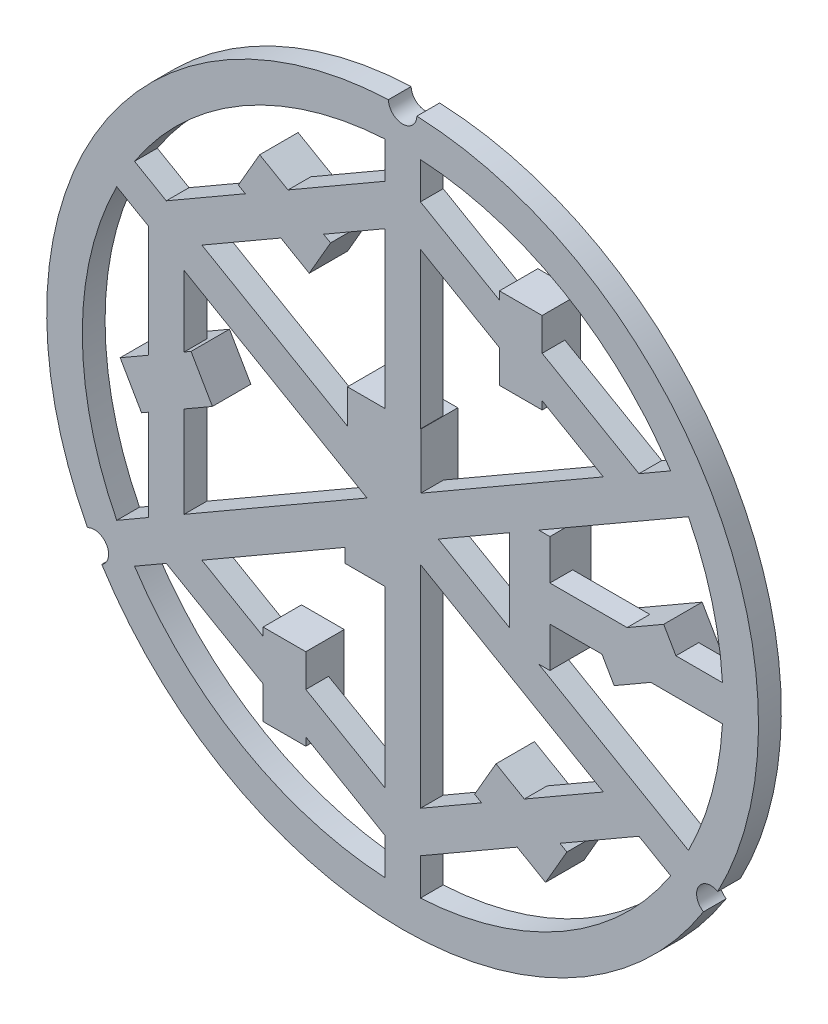
from build123d import *

# Parameters (mm, degrees)
BASE_SKETCH_R        = 25
BOARD_DEPTH          = 1.6
ALIGNMENT_SLOTS_D    = 2
EXTRUSION_BASE_W     = 3
EXTRUSION_BASE_H     = 5.75
LEDS_DEPTH           = 1.1
EXTRUSION_BASE_3_W   = 5.15
EXTRUSION_BASE_3_H   = 5.15
EXTRUSION_BASE_3_W_2 = 3.1
EXTRUSION_BASE_3_H_2 = 3.1
ICS_DEPTH            = 1
EXTRUSION_BASE_4_W   = 2.85
EXTRUSION_BASE_4_H   = 8.15
CONNECTOR_DEPTH      = 1.3
EXTRA_MASS_CUT_DEPTH = 36.391524409


with BuildPart() as part:
    # Base sketch → Board (new body)
    with BuildSketch(Plane.XY):
        Circle(BASE_SKETCH_R)
    extrude(amount=BOARD_DEPTH)

    # Alignment slots (through all)
    with Locations(Plane.XY.offset(1.6)):
        with Locations((0, 25), (21.650635095, -12.5), (-21.650635095, -12.5)):
            Hole(ALIGNMENT_SLOTS_D / 2)

    # Extrusion base → LEDs (add)
    with BuildSketch(Plane(origin=(0, 0, 0), x_dir=(-1, 0, 0), z_dir=(0, 0, -1))):
        Polygon((11.539823036, 14.514483597), (10.039823036, 17.112559808), (5.060176964, 14.237559808), (6.560176964, 11.639483597), align=None)
        with Locations((-8.3, 14.376021703)):
            Rectangle(EXTRUSION_BASE_W, EXTRUSION_BASE_H)
        Polygon((18.339823036, -2.736538106), (19.839823036, -0.138461894), (14.860176964, 2.736538106), (13.360176964, 0.138461894), align=None)
        with Locations((8.3, -14.376021703)):
            Rectangle(EXTRUSION_BASE_W, EXTRUSION_BASE_H)
        Polygon((-11.539823036, -14.514483597), (-10.039823036, -17.112559808), (-5.060176964, -14.237559808), (-6.560176964, -11.639483597), align=None)
        Polygon((-18.339823036, 2.736538106), (-19.839823036, 0.138461894), (-14.860176964, -2.736538106), (-13.360176964, -0.138461894), align=None)
    extrude(amount=LEDS_DEPTH)

    # Extrusion base<3> → ICs (add)
    with BuildSketch(Plane(origin=(0, 0, 0), x_dir=(-1, 0, 0), z_dir=(0, 0, -1))):
        with Locations((1.3, 3.5)):
            Rectangle(EXTRUSION_BASE_3_W, EXTRUSION_BASE_3_H)
        with Locations((2.5, -3.2)):
            Rectangle(EXTRUSION_BASE_3_W_2, EXTRUSION_BASE_3_H_2)
    extrude(amount=ICS_DEPTH)

    # Extrusion base<4> → Connector (add)
    with BuildSketch(Plane(origin=(0, 0, 0), x_dir=(-1, 0, 0), z_dir=(0, 0, -1))):
        with Locations((-8.92, 0)):
            Rectangle(EXTRUSION_BASE_4_W, EXTRUSION_BASE_4_H)
    extrude(amount=CONNECTOR_DEPTH)

    # Negative base → Extra mass cut (cut, through all)
    with BuildSketch(Plane(origin=(0, 0, 0), x_dir=(-1, 0, 0), z_dir=(0, 0, -1))):
        Polygon((3.875, 3.680607966), (14.1, 9.584014469), (8.55, 12.788308463), (6.560176964, 11.639483597), (5.060176964, 14.237559808), (5.55, 14.52035927), (1.25, 17.002965428), (1.25, 6.075), (3.875, 6.075), align=None)
        with BuildLine():
            Line((11.05, 14.231684136), (16.6, 11.027390142))
            Line((16.6, 11.027390142), (18.83047802, 12.315157227))
            ThreePointArc((18.83047802, 12.315157227), (11.25, 19.485571585), (1.25, 22.465250945))
            Line((1.25, 22.465250945), (1.25, 19.889716774))
            Line((1.25, 19.889716774), (8.05, 15.963734943))
            Line((8.05, 15.963734943), (10.039823036, 17.112559808))
            Line((10.039823036, 17.112559808), (11.539823036, 14.514483597))
            Line((11.539823036, 14.514483597), (11.05, 14.231684136))
        make_face()
        with BuildLine():
            ThreePointArc((20.08047802, -10.150093718), (22.5, 0), (20.08047802, 10.150093718))
            Line((20.08047802, 10.150093718), (17.85, 8.862326632))
            Line((17.85, 8.862326632), (17.85, 1.010362971))
            Line((17.85, 1.010362971), (19.839823036, -0.138461894))
            Line((19.839823036, -0.138461894), (18.339823036, -2.736538106))
            Line((18.339823036, -2.736538106), (17.85, -2.453738644))
            Line((17.85, -2.453738644), (17.85, -8.862326632))
            Line((17.85, -8.862326632), (20.08047802, -10.150093718))
        make_face()
        with BuildLine():
            Line((-1.25, 19.889716774), (-1.25, 22.465250945))
            ThreePointArc((-1.25, 22.465250945), (-11.25, 19.485571585), (-18.83047802, 12.315157227))
            Line((-18.83047802, 12.315157227), (-16.6, 11.027390142))
            Line((-16.6, 11.027390142), (-9.8, 14.953371972))
            Line((-9.8, 14.953371972), (-9.8, 17.251021703))
            Line((-9.8, 17.251021703), (-6.8, 17.251021703))
            Line((-6.8, 17.251021703), (-6.8, 16.68542278))
            Line((-6.8, 16.68542278), (-1.25, 19.889716774))
        make_face()
        Polygon((-1.275, 6.075), (-1.25, 6.075), (-1.25, 17.002965428), (-6.8, 13.798671434), (-6.8, 11.501021703), (-9.8, 11.501021703), (-9.8, 12.066620626), (-14.1, 9.584014469), (-1.275, 2.179497266), align=None)
        Polygon((15.35, 2.453738644), (15.35, 7.418950959), (2.5, 0), (15.35, -7.418950959), (15.35, -1.010362971), (13.360176964, 0.138461894), (14.860176964, 2.736538106), align=None)
        with BuildLine():
            ThreePointArc((1.25, -22.465250945), (11.25, -19.485571585), (18.83047802, -12.315157227))
            Line((18.83047802, -12.315157227), (16.6, -11.027390142))
            Line((16.6, -11.027390142), (9.8, -14.953371972))
            Line((9.8, -14.953371972), (9.8, -17.251021703))
            Line((9.8, -17.251021703), (6.8, -17.251021703))
            Line((6.8, -17.251021703), (6.8, -16.68542278))
            Line((6.8, -16.68542278), (1.25, -19.889716774))
            Line((1.25, -19.889716774), (1.25, -22.465250945))
        make_face()
        with BuildLine():
            Line((-9.558107041, 4.075), (-20.08047802, 10.150093718))
            ThreePointArc((-20.08047802, 10.150093718), (-21.733331092, 5.823428515), (-22.465250945, 1.25))
            Line((-22.465250945, 1.25), (-19.198076211, 1.25))
            Line((-19.198076211, 1.25), (-18.339823036, 2.736538106))
            Line((-18.339823036, 2.736538106), (-15.765063509, 1.25))
            Line((-15.765063509, 1.25), (-10.345, 1.25))
            Line((-10.345, 1.25), (-10.345, 4.075))
            Line((-10.345, 4.075), (-9.558107041, 4.075))
        make_face()
        Polygon((-7.495, -2.883864595), (-2.5, 0), (-7.495, 2.883864595), align=None)
        Polygon((-1.25, -17.002965428), (-1.25, -2.165063509), (-14.1, -9.584014469), (-8.55, -12.788308463), (-6.560176964, -11.639483597), (-5.060176964, -14.237559808), (-5.55, -14.52035927), align=None)
        Polygon((9.8, -12.066620626), (14.1, -9.584014469), (4.05, -3.781644263), (4.05, -4.75), (1.25, -4.75), (1.25, -17.002965428), (6.8, -13.798671434), (6.8, -11.501021703), (9.8, -11.501021703), align=None)
        with BuildLine():
            ThreePointArc((-18.83047802, -12.315157227), (-11.25, -19.485571585), (-1.25, -22.465250945))
            Line((-1.25, -22.465250945), (-1.25, -19.889716774))
            Line((-1.25, -19.889716774), (-8.05, -15.963734943))
            Line((-8.05, -15.963734943), (-10.039823036, -17.112559808))
            Line((-10.039823036, -17.112559808), (-11.539823036, -14.514483597))
            Line((-11.539823036, -14.514483597), (-11.05, -14.231684136))
            Line((-11.05, -14.231684136), (-16.6, -11.027390142))
            Line((-16.6, -11.027390142), (-18.83047802, -12.315157227))
        make_face()
        with BuildLine():
            Line((-17.434936491, -1.25), (-22.465250945, -1.25))
            ThreePointArc((-22.465250945, -1.25), (-21.733331092, -5.823428515), (-20.08047802, -10.150093718))
            Line((-20.08047802, -10.150093718), (-9.558107041, -4.075))
            Line((-9.558107041, -4.075), (-10.345, -4.075))
            Line((-10.345, -4.075), (-10.345, -1.25))
            Line((-10.345, -1.25), (-14.001923789, -1.25))
            Line((-14.001923789, -1.25), (-14.860176964, -2.736538106))
            Line((-14.860176964, -2.736538106), (-17.434936491, -1.25))
        make_face()
    extrude(amount=-EXTRA_MASS_CUT_DEPTH, mode=Mode.SUBTRACT)


solid = part.part
